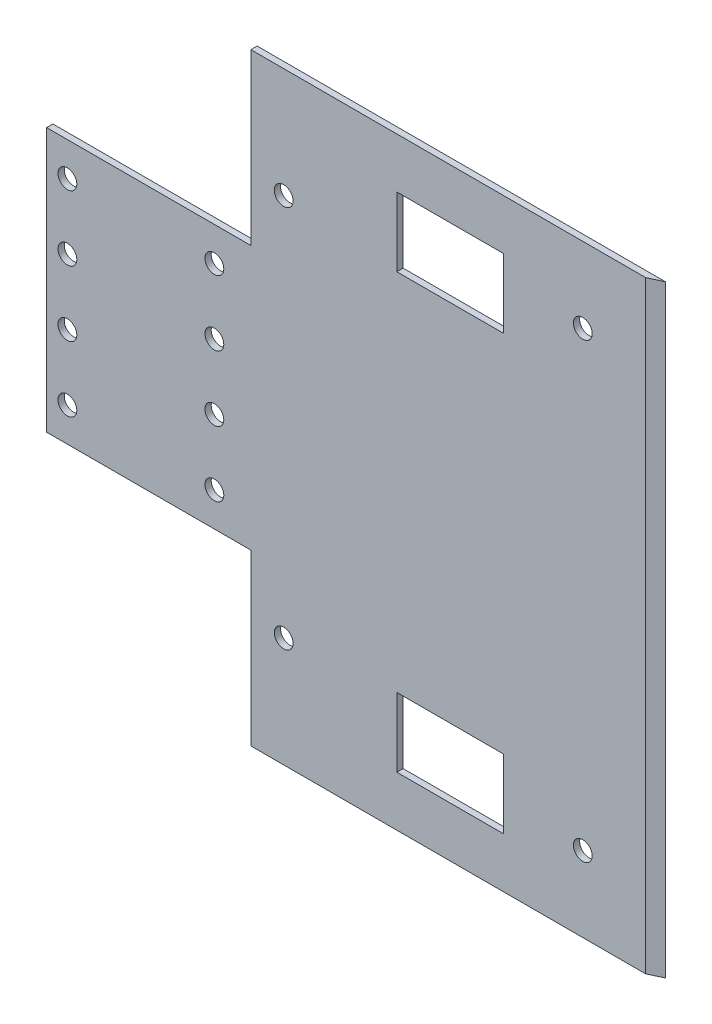
from build123d import *

# Parameters (mm, degrees)
SKETCH_1_R          = 1.5
SKETCH_1_W          = 17
SKETCH_1_H          = 11
EXTRUDE_1_DEPTH     = 1
CUT_EXTRUDE_1_DEPTH = 109.245092268


with BuildPart() as part:
    # Эскиз1 → Бобышка-Вытянуть1 (new body)
    with BuildSketch(Plane(origin=(0, 0, 0), x_dir=(-1, 0, 0), z_dir=(0, 0, 1))):
        Polygon((47.5, 21), (15, 21), (15, 48), (-50, 48), (-50, -48), (15, -48), (15, -21), (47.5, -21), align=None)
        with Locations(Location((20.8, -15.6, 0), (0, 0, 180))):
            Circle(SKETCH_1_R, mode=Mode.SUBTRACT)
        with Locations(Location((20.8, -5.2, 0), (0, 0, 180))):
            Circle(SKETCH_1_R, mode=Mode.SUBTRACT)
        with Locations(Location((20.8, 5.2, 0), (0, 0, 180))):
            Circle(SKETCH_1_R, mode=Mode.SUBTRACT)
        with Locations(Location((20.8, 15.6, 0), (0, 0, 180))):
            Circle(SKETCH_1_R, mode=Mode.SUBTRACT)
        with Locations(Location((44.2, -15.6, 0), (0, 0, 180))):
            Circle(SKETCH_1_R, mode=Mode.SUBTRACT)
        with Locations(Location((44.2, -5.2, 0), (0, 0, 180))):
            Circle(SKETCH_1_R, mode=Mode.SUBTRACT)
        with Locations(Location((44.2, 5.2, 0), (0, 0, 180))):
            Circle(SKETCH_1_R, mode=Mode.SUBTRACT)
        with Locations(Location((44.2, 15.6, 0), (0, 0, 180))):
            Circle(SKETCH_1_R, mode=Mode.SUBTRACT)
        with Locations(Location((9.763297689, -30.5, 0), (0, 0, 180))):
            Circle(SKETCH_1_R, mode=Mode.SUBTRACT)
        with Locations(Location((9.763297689, 30.5, 0), (0, 0, 180))):
            Circle(SKETCH_1_R, mode=Mode.SUBTRACT)
        with Locations(Location((-37.855493079, -36, 0), (0, 0, 180))):
            Circle(SKETCH_1_R, mode=Mode.SUBTRACT)
        with Locations(Location((-37.855493079, 36, 0), (0, 0, 180))):
            Circle(SKETCH_1_R, mode=Mode.SUBTRACT)
        with Locations((-16.751430991, 34.5)):
            Rectangle(SKETCH_1_W, SKETCH_1_H, mode=Mode.SUBTRACT)
        with Locations((-16.751430991, -34.5)):
            Rectangle(SKETCH_1_W, SKETCH_1_H, mode=Mode.SUBTRACT)
    extrude(amount=EXTRUDE_1_DEPTH)

    # Эскиз2 → Вырез-Вытянуть1 (cut, through all)
    with BuildSketch(Plane(origin=(0, 48, 0), x_dir=(1, 0, 0), z_dir=(0, 1, 0))):
        Polygon((47.855493079, -1), (50, 0), (50, -1), align=None)
    extrude(amount=-CUT_EXTRUDE_1_DEPTH, mode=Mode.SUBTRACT)


solid = part.part
